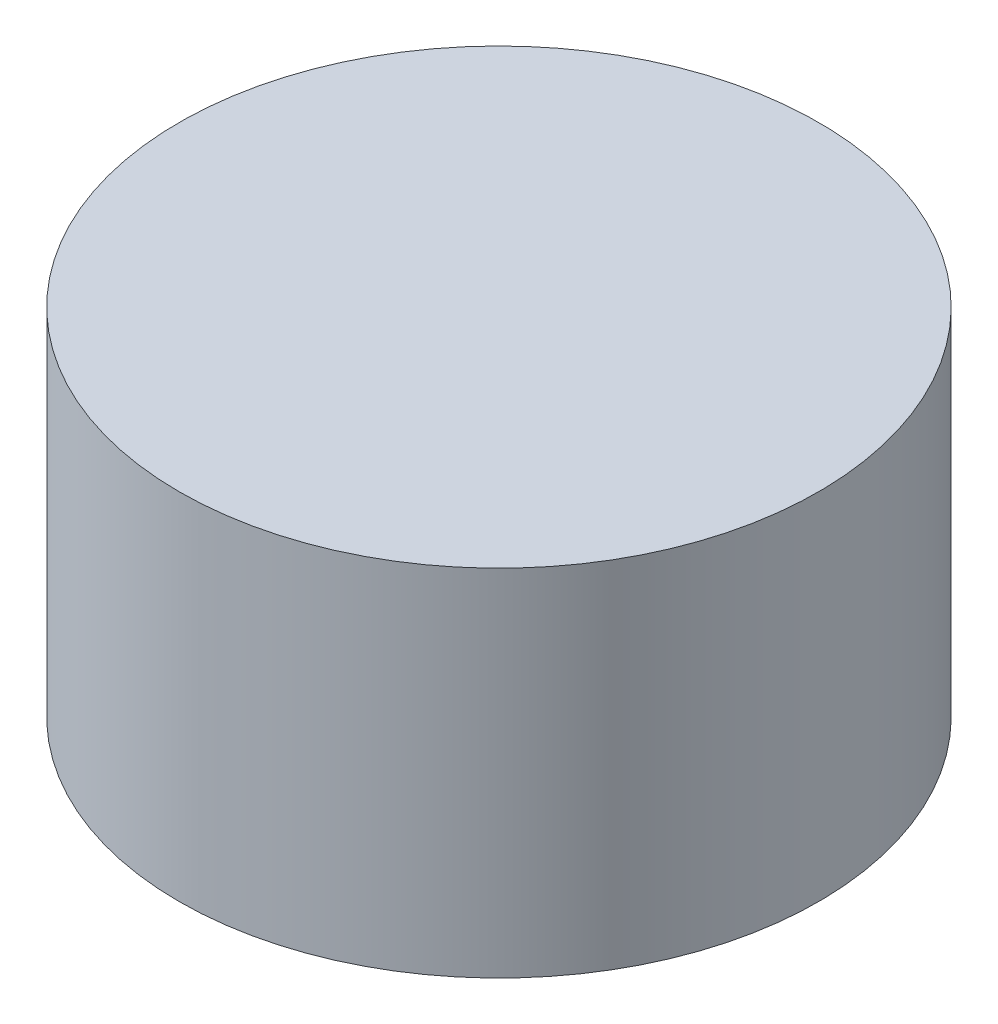
from build123d import *

# Parameters (mm, degrees)
SKETCH1_R           = 3
BOSS_EXTRUDE1_DEPTH = 3.33


with BuildPart() as part:
    # Sketch1 → Boss-Extrude1 (new body)
    with BuildSketch(Plane(origin=(0, 0, 0), x_dir=(1, 0, 0), z_dir=(0, 1, 0))):
        with Locations(Location((0, 0, 0), (0, 0, 270))):
            Circle(SKETCH1_R)
    extrude(amount=BOSS_EXTRUDE1_DEPTH)


solid = part.part
